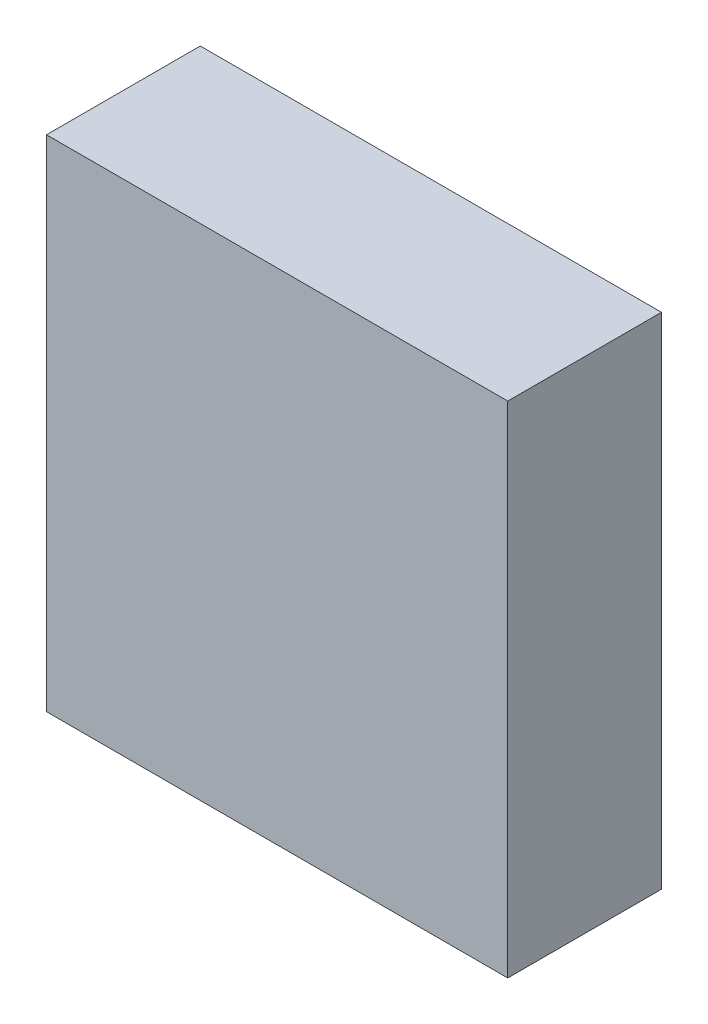
from build123d import *

# Parameters (mm, degrees)
SKETCH2_W           = 1828.8
SKETCH2_H           = 609.6
BOSS_EXTRUDE1_DEPTH = 1981.2


with BuildPart() as part:
    # Sketch2 → Boss-Extrude1 (new body)
    with BuildSketch(Plane(origin=(0, 0, 0), x_dir=(1, 0, 0), z_dir=(0, 1, 0))):
        with Locations((914.4, 304.8)):
            Rectangle(SKETCH2_W, SKETCH2_H)
    extrude(amount=BOSS_EXTRUDE1_DEPTH)


solid = part.part
